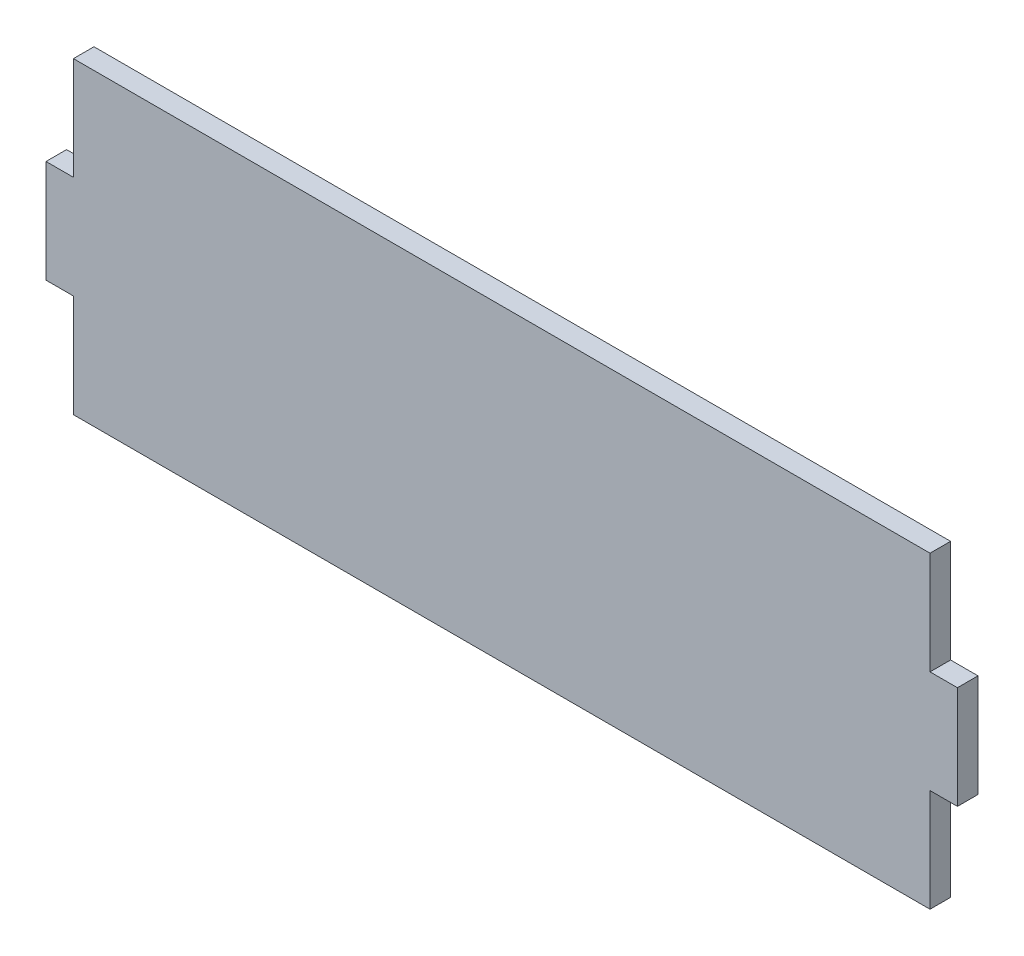
from build123d import *

# Parameters (mm, degrees)
SKETCH1_W           = 125
SKETCH1_H           = 45
BOSS_EXTRUDE1_DEPTH = 3
SKETCH2_W           = 4
SKETCH2_H           = 15
BOSS_EXTRUDE2_DEPTH = 3


with BuildPart() as part:
    # Sketch1 → Boss-Extrude1 (new body)
    with BuildSketch(Plane.XY):
        with Locations((-62.5, 22.5)):
            Rectangle(SKETCH1_W, SKETCH1_H)
    extrude(amount=BOSS_EXTRUDE1_DEPTH)

    # Sketch2 → Boss-Extrude2 (add)
    with BuildSketch(Plane.XY.offset(3)):
        with Locations((2, 22.5)):
            Rectangle(SKETCH2_W, SKETCH2_H)
        with Locations((-127, 22.5)):
            Rectangle(SKETCH2_W, SKETCH2_H)
    extrude(amount=-BOSS_EXTRUDE2_DEPTH)


solid = part.part
